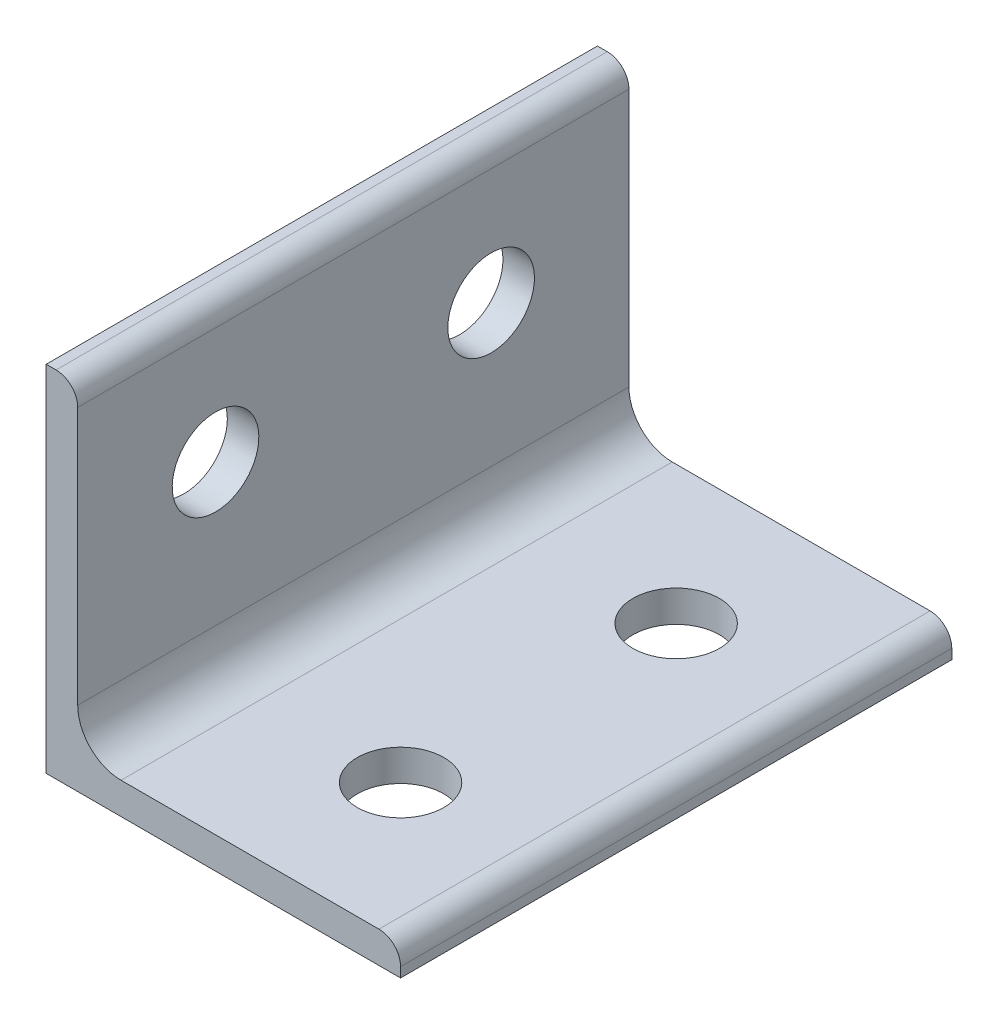
from build123d import *

# Parameters (mm, degrees)
BOSS_EXTRUDE1_DEPTH        = 70
F_22_0_22_DIAMETER_HOLE1_D = 22
LPATTERN1_COUNT            = 2
LPATTERN1_PITCH            = 70
CIRPATTERN1_COUNT          = 2
CIRPATTERN1_ANGLE          = 90
CIRPATTERN1_COPY_1_D       = 22


with BuildPart() as part:
    # Sketch1 → Boss-Extrude1 (new, symmetric)
    with BuildSketch(Plane.XY):
        with BuildLine():
            Line((0, 90), (0, 0))
            Line((0, 0), (90, 0))
            Line((90, 0), (90, 2.5))
            ThreePointArc((90, 2.5), (88.389087297, 6.389087297), (84.5, 8))
            Line((84.5, 8), (19, 8))
            ThreePointArc((19, 8), (11.221825407, 11.221825407), (8, 19))
            Line((8, 19), (8, 84.5))
            ThreePointArc((8, 84.5), (6.389087297, 88.389087297), (2.5, 90))
            Line((2.5, 90), (0, 90))
        make_face()
    extrude(amount=BOSS_EXTRUDE1_DEPTH, both=True)

    # Ø22.0 (22) Diameter Hole1 (through all)
    with Locations(Plane(origin=(0, 8, 0), x_dir=(1, 0, 0), z_dir=(0, 1, 0))):
        with Locations((55, -35)):
            f_22_0_22_diameter_hole1 = Hole(F_22_0_22_DIAMETER_HOLE1_D / 2)

    # LPattern1: Ø22.0 (22) Diameter Hole1 ×2
    with Locations(*[(0, 0, -i * LPATTERN1_PITCH) for i in range(1, LPATTERN1_COUNT)]):
        add(f_22_0_22_diameter_hole1, mode=Mode.SUBTRACT)

    # CirPattern1: Ø22.0 (22) Diameter Hole1 ×2 about axis
    cirpattern1_axis = Axis((0, 0, 55), (0, 0, 1))
    for i in range(1, CIRPATTERN1_COUNT):
        add(f_22_0_22_diameter_hole1.rotate(cirpattern1_axis, i * CIRPATTERN1_ANGLE / (CIRPATTERN1_COUNT - 1)), mode=Mode.SUBTRACT)

    # CirPattern1 copy 1 (through all)
    with Locations(Plane(origin=(-8, 0, -70), x_dir=(0, 1, 0), z_dir=(-1, 0, 0))):
        with Locations((55, -35)):
            Hole(CIRPATTERN1_COPY_1_D / 2)


solid = part.part
